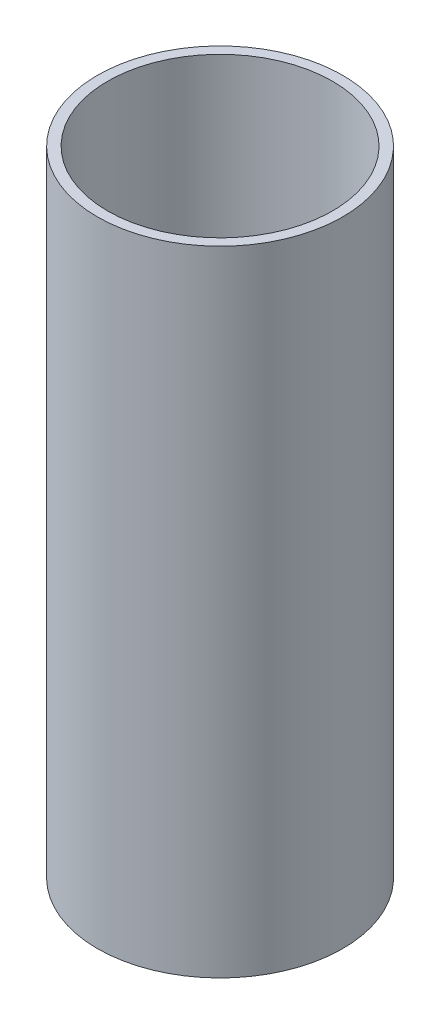
from build123d import *

# Parameters (mm, degrees)
SKETCH1_R           = 19.05
BOSS_EXTRUDE1_DEPTH = 98.425
SKETCH2_R           = 17.4625
CUT_EXTRUDE1_DEPTH  = 69.85
SKETCH3_R           = 11.1125
CUT_EXTRUDE2_DEPTH  = 25.4


with BuildPart() as part:
    # Sketch1 → Boss-Extrude1 (new body)
    with BuildSketch(Plane(origin=(0, 0, 0), x_dir=(1, 0, 0), z_dir=(0, 1, 0))):
        with Locations(Location((0.701910904, 0, 0), (0, 0, 270))):
            Circle(SKETCH1_R)
    extrude(amount=BOSS_EXTRUDE1_DEPTH)

    # Sketch2 → Cut-Extrude1 (cut)
    with BuildSketch(Plane(origin=(0, 98.425, 0), x_dir=(1, 0, 0), z_dir=(0, 1, 0))):
        with Locations(Location((0.701910904, 0, 0), (0, 0, 270))):
            Circle(SKETCH2_R)
    extrude(amount=-CUT_EXTRUDE1_DEPTH, mode=Mode.SUBTRACT)

    # Sketch3 → Cut-Extrude2 (cut)
    with BuildSketch(Plane(origin=(0, 28.575, 0), x_dir=(1, 0, 0), z_dir=(0, 1, 0))):
        with Locations(Location((0.701910904, 0, 0), (0, 0, 270))):
            Circle(SKETCH3_R)
    extrude(amount=-CUT_EXTRUDE2_DEPTH, mode=Mode.SUBTRACT)


solid = part.part
